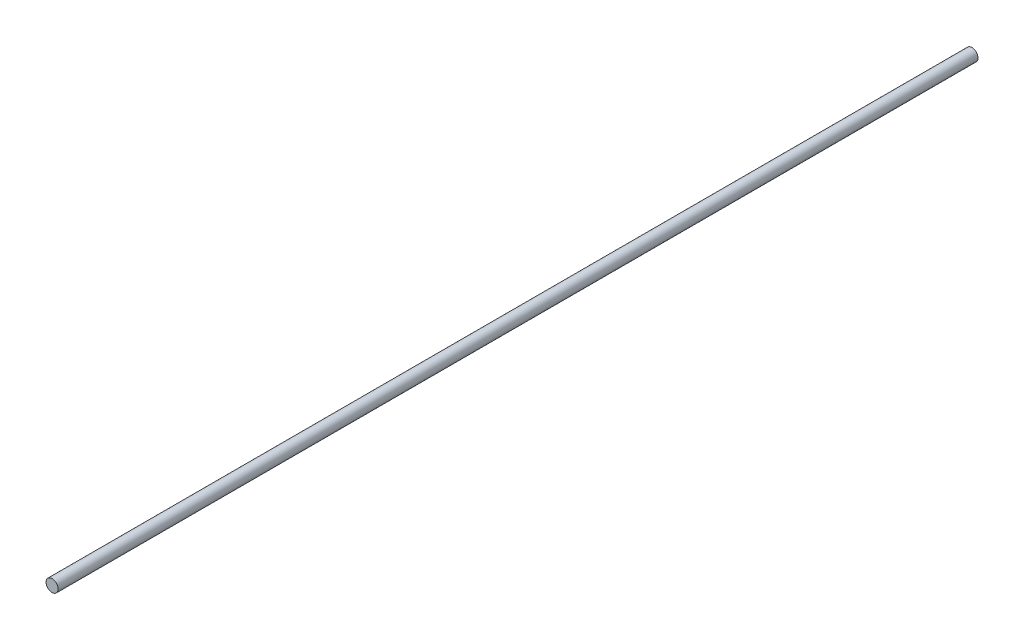
from build123d import *

# Parameters (mm, degrees)
SKETCH1_R           = 3.175
BOSS_EXTRUDE1_DEPTH = 482.6


with BuildPart() as part:
    # Sketch1 → Boss-Extrude1 (new body)
    with BuildSketch(Plane.XY):
        with Locations(Location((0, 0, 0), (0, 0, 180))):
            Circle(SKETCH1_R)
    extrude(amount=BOSS_EXTRUDE1_DEPTH)


solid = part.part
